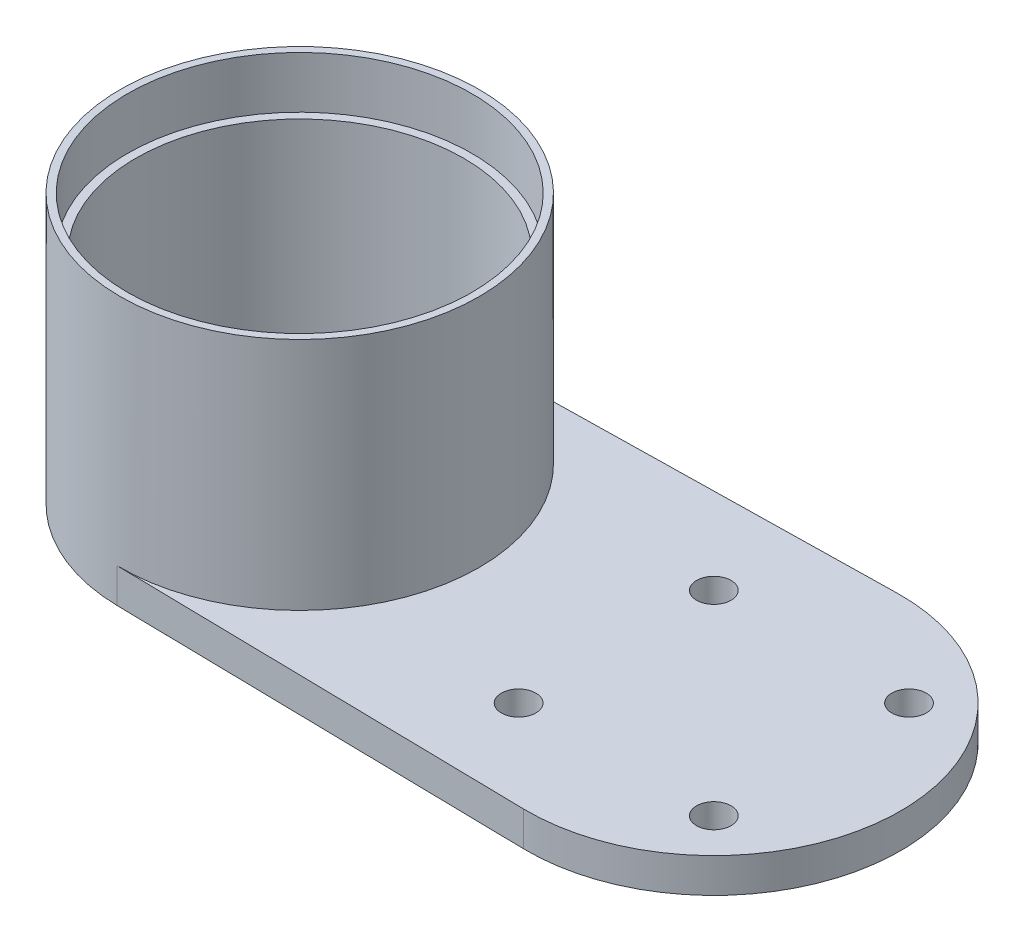
from build123d import *

# Parameters (mm, degrees)
SKETCH1_R           = 26
SKETCH1_R_2         = 24.95
BOSS_EXTRUDE1_DEPTH = 7.5
BOSS_EXTRUDE2_START = 31.5
SKETCH2_R           = 26
SKETCH2_R_2         = 23.75
BOSS_EXTRUDE2_DEPTH = 31.5
SKETCH3_R           = 23.75
BOSS_EXTRUDE3_DEPTH = 1
SKETCH4_R           = 3
CUT_EXTRUDE1_DEPTH  = 1
BOSS_EXTRUDE4_DEPTH = 5
SKETCH6_R           = 2.5
CUT_EXTRUDE2_DEPTH  = 5


with BuildPart() as part:
    # Sketch1 → Boss-Extrude1 (new body)
    with BuildSketch(Plane(origin=(0, 0, 0), x_dir=(1, 0, 0), z_dir=(0, 1, 0))):
        with Locations(Location((0, 0, 0), (0, 0, 270))):
            Circle(SKETCH1_R)
        with Locations(Location((0, 0, 0), (0, 0, 270))):
            Circle(SKETCH1_R_2, mode=Mode.SUBTRACT)
    extrude(amount=BOSS_EXTRUDE1_DEPTH)

    # Sketch2 → Boss-Extrude2 (add)
    with BuildSketch(Plane.XZ.offset(BOSS_EXTRUDE2_START)):
        with Locations(Location((0, 0, 0), (0, 0, 270))):
            Circle(SKETCH2_R)
        with Locations(Location((0, 0, 0), (0, 0, 270))):
            Circle(SKETCH2_R_2, mode=Mode.SUBTRACT)
    extrude(amount=-BOSS_EXTRUDE2_DEPTH)

    # Sketch3 → Boss-Extrude3 (add)
    with BuildSketch(Plane.XZ.offset(31.5)):
        with Locations(Location((0, 0, 0), (0, 0, 270))):
            Circle(SKETCH3_R)
    extrude(amount=-BOSS_EXTRUDE3_DEPTH)

    # Sketch4 → Cut-Extrude1 (cut)
    with BuildSketch(Plane.XZ.offset(31.5)):
        with Locations(Location((0, 0, 0), (0, 0, 270))):
            Circle(SKETCH4_R)
    extrude(amount=-CUT_EXTRUDE1_DEPTH, mode=Mode.SUBTRACT)

    # Sketch5 → Boss-Extrude4 (add)
    with BuildSketch(Plane.XZ.offset(31.5)):
        with BuildLine():
            Line((-0.468, 25.995787659), (59.51256, 27.075612685))
            ThreePointArc((59.51256, 27.075612685), (87.08, 0), (59.51256, -27.075612685))
            Line((59.51256, -27.075612685), (-0.468, -25.995787659))
            ThreePointArc((-0.468, -25.995787659), (26, 0), (-0.468, 25.995787659))
        make_face()
    extrude(amount=-BOSS_EXTRUDE4_DEPTH)

    # Sketch6 → Cut-Extrude2 (cut)
    with BuildSketch(Plane.XZ.offset(31.5)):
        with Locations(Location((74.142135624, 14.142135624, 0), (0, 0, 270))):
            Circle(SKETCH6_R)
        with Locations(Location((74.142135624, -14.142135624, 0), (0, 0, 270))):
            Circle(SKETCH6_R)
        with Locations(Location((45.857864376, -14.142135624, 0), (0, 0, 270))):
            Circle(SKETCH6_R)
        with Locations(Location((45.857864376, 14.142135624, 0), (0, 0, 270))):
            Circle(SKETCH6_R)
    extrude(amount=-CUT_EXTRUDE2_DEPTH, mode=Mode.SUBTRACT)


solid = part.part
